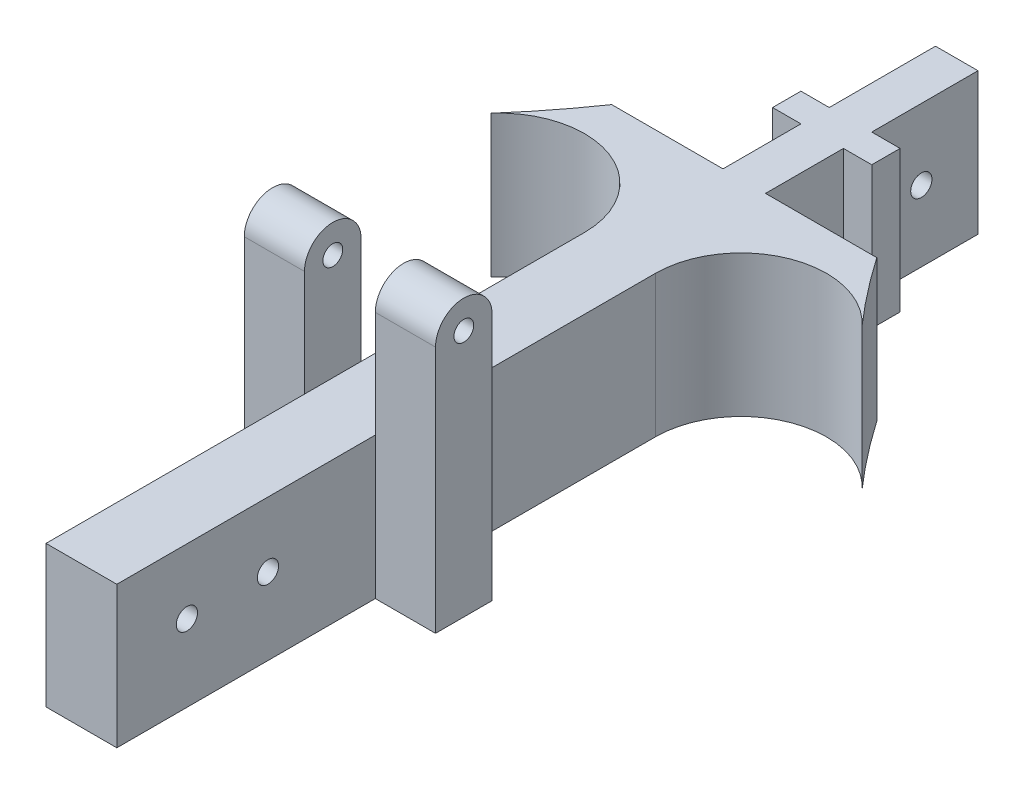
from build123d import *

# Parameters (mm, degrees)
BOSS_EXTRU_1_DEPTH      = 20
ESQUISSE3_R             = 1.5
ENL_V_MAT_EXTRU_3_DEPTH = 20
ESQUISSE4_R             = 1.5
ENL_V_MAT_EXTRU_4_DEPTH = 10
ESQUISSE5_R             = 1.5
ENL_V_MAT_EXTRU_5_DEPTH = 10
ESQUISSE6_R             = 1.4
BOSS_EXTRU_2_DEPTH      = 8.5


with BuildPart() as part:
    # Esquisse1 → Boss.-Extru.1 (new body)
    with BuildSketch(Plane(origin=(0, 0, 0), x_dir=(1, 0, 0), z_dir=(0, 1, 0))):
        with BuildLine():
            Line((-3, 84.398281038), (-3, 69.398281038))
            Line((-3, 69.398281038), (-7, 69.398281038))
            Line((-7, 69.398281038), (-7, 65.398281038))
            Line((-7, 65.398281038), (-3, 65.398281038))
            Line((-3, 65.398281038), (-3, 54.398281038))
            Line((-3, 54.398281038), (-18.71, 54.398281038))
            ThreePointArc((-18.71, 54.398281038), (-22.308577777, 49.499317693), (-26.183329952, 44.81574006))
            ThreePointArc((-26.183329952, 44.81574006), (-12.83252844, 48.159570073), (-5, 36.842476876))
            Line((-5, 36.842476876), (-5, -39.182739587))
            Line((-5, -39.182739587), (0, -39.182739587))
            Line((0, -39.182739587), (0, 84.398281038))
            Line((0, 84.398281038), (-3, 84.398281038))
        make_face()
    boss_extru_1 = extrude(amount=BOSS_EXTRU_1_DEPTH)

    # Symétrie1: Boss.-Extru.1 across plane
    add(boss_extru_1.mirror(Plane(origin=(0, 20, -84.398281038), x_dir=(0, 0, 1), z_dir=(-1, 0, 0))))

    # Esquisse3 → Enlèv. mat.-Extru.3 (cut)
    with BuildSketch(Plane.ZY.offset(3)):
        with Locations((-76.398281038, 10)):
            Circle(ESQUISSE3_R)
        with Locations((-60.398281038, 10)):
            Circle(ESQUISSE3_R)
    extrude(amount=-ENL_V_MAT_EXTRU_3_DEPTH, mode=Mode.SUBTRACT)

    # Esquisse4 → Enlèv. mat.-Extru.4 (cut)
    with BuildSketch(Plane.ZY.offset(5)):
        with Locations((29.291975875, 10.84)):
            Circle(ESQUISSE4_R)
    extrude(amount=-ENL_V_MAT_EXTRU_4_DEPTH, mode=Mode.SUBTRACT)

    # Esquisse5 → Enlèv. mat.-Extru.5 (cut)
    with BuildSketch(Plane.ZY.offset(5)):
        with Locations((17.841975875, 10.84)):
            Circle(ESQUISSE5_R)
    extrude(amount=-ENL_V_MAT_EXTRU_5_DEPTH, mode=Mode.SUBTRACT)

    # Esquisse6 → Boss.-Extru.2 (add)
    with BuildSketch(Plane(origin=(5, 0, 0), x_dir=(0, 0, -1), z_dir=(1, 0, 0))):
        with BuildLine():
            Line((5.308208853, 0), (-2.691791147, 0))
            Line((-2.691791147, 0), (-2.691791147, 35))
            ThreePointArc((-2.691791147, 35), (1.308208853, 39), (5.308208853, 35))
            Line((5.308208853, 35), (5.308208853, 0))
        make_face()
        with Locations((1.308208853, 35)):
            Circle(ESQUISSE6_R, mode=Mode.SUBTRACT)
    boss_extru_2 = extrude(amount=BOSS_EXTRU_2_DEPTH)

    # Symétrie2: Boss.-Extru.2 across plane
    add(boss_extru_2.mirror(Plane.ZY))


solid = part.part
